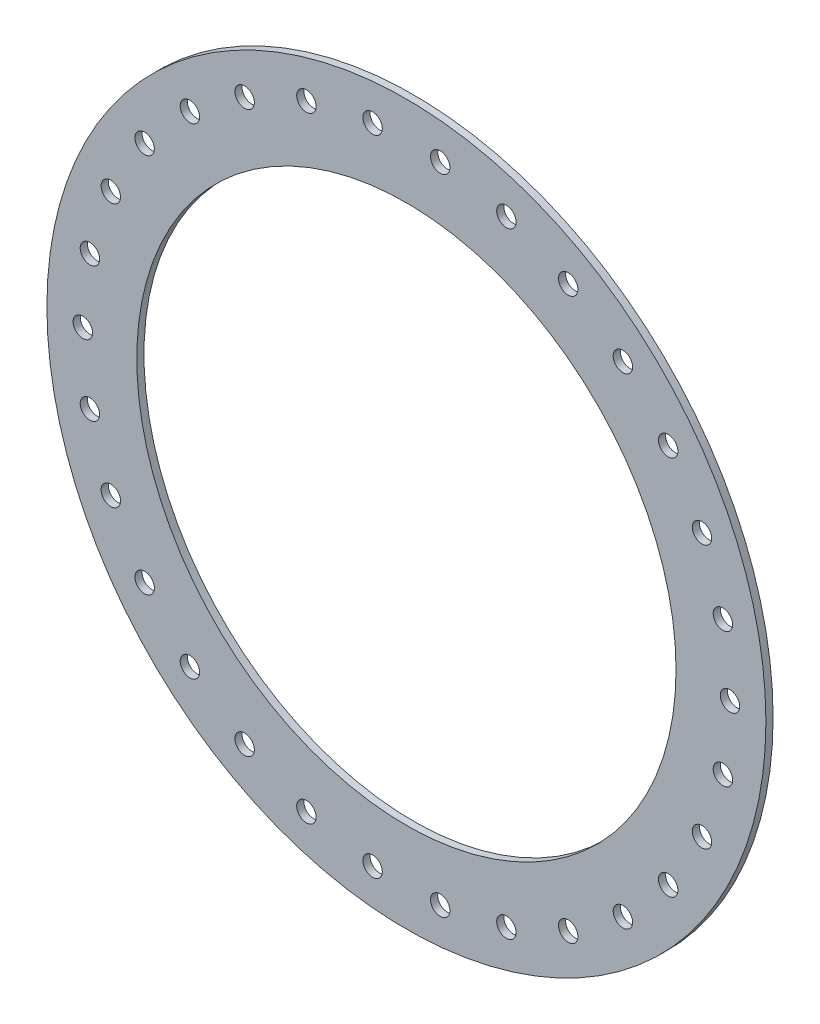
from build123d import *

# Parameters (mm, degrees)
CROQUIS1_R              = 200
CROQUIS1_R_2            = 150
CROQUIS1_R_3            = 5.4
SALIENTE_EXTRUIR1_DEPTH = 4


with BuildPart() as part:
    # Croquis1 → Saliente-Extruir1 (new body)
    with BuildSketch(Plane.XY):
        Circle(CROQUIS1_R)
        Circle(CROQUIS1_R_2, mode=Mode.SUBTRACT)
        with Locations((145.623058987, 105.801345413)):
            Circle(CROQUIS1_R_3, mode=Mode.SUBTRACT)
        with Locations((164.438182376, 73.212595754)):
            Circle(CROQUIS1_R_3, mode=Mode.SUBTRACT)
        with Locations((176.066568132, 37.424104347)):
            Circle(CROQUIS1_R_3, mode=Mode.SUBTRACT)
        with Locations((180, 0)):
            Circle(CROQUIS1_R_3, mode=Mode.SUBTRACT)
        with Locations((176.066568132, -37.424104347)):
            Circle(CROQUIS1_R_3, mode=Mode.SUBTRACT)
        with Locations((164.438182376, -73.212595754)):
            Circle(CROQUIS1_R_3, mode=Mode.SUBTRACT)
        with Locations((145.623058987, -105.801345413)):
            Circle(CROQUIS1_R_3, mode=Mode.SUBTRACT)
        with Locations((120.443509145, -133.766068586)):
            Circle(CROQUIS1_R_3, mode=Mode.SUBTRACT)
        with Locations((90, -155.884572681)):
            Circle(CROQUIS1_R_3, mode=Mode.SUBTRACT)
        with Locations((55.623058987, -171.190172933)):
            Circle(CROQUIS1_R_3, mode=Mode.SUBTRACT)
        with Locations((18.815123388, -179.013941166)):
            Circle(CROQUIS1_R_3, mode=Mode.SUBTRACT)
        with Locations((-18.815123388, -179.013941166)):
            Circle(CROQUIS1_R_3, mode=Mode.SUBTRACT)
        with Locations((-55.623058987, -171.190172933)):
            Circle(CROQUIS1_R_3, mode=Mode.SUBTRACT)
        with Locations((-90, -155.884572681)):
            Circle(CROQUIS1_R_3, mode=Mode.SUBTRACT)
        with Locations((-120.443509145, -133.766068586)):
            Circle(CROQUIS1_R_3, mode=Mode.SUBTRACT)
        with Locations((-145.623058987, -105.801345413)):
            Circle(CROQUIS1_R_3, mode=Mode.SUBTRACT)
        with Locations((-164.438182376, -73.212595754)):
            Circle(CROQUIS1_R_3, mode=Mode.SUBTRACT)
        with Locations((-176.066568132, -37.424104347)):
            Circle(CROQUIS1_R_3, mode=Mode.SUBTRACT)
        with Locations((-180, 0)):
            Circle(CROQUIS1_R_3, mode=Mode.SUBTRACT)
        with Locations((-176.066568132, 37.424104347)):
            Circle(CROQUIS1_R_3, mode=Mode.SUBTRACT)
        with Locations((-164.438182376, 73.212595754)):
            Circle(CROQUIS1_R_3, mode=Mode.SUBTRACT)
        with Locations((-145.623058987, 105.801345413)):
            Circle(CROQUIS1_R_3, mode=Mode.SUBTRACT)
        with Locations((-120.443509145, 133.766068586)):
            Circle(CROQUIS1_R_3, mode=Mode.SUBTRACT)
        with Locations((-90, 155.884572681)):
            Circle(CROQUIS1_R_3, mode=Mode.SUBTRACT)
        with Locations((-55.623058987, 171.190172933)):
            Circle(CROQUIS1_R_3, mode=Mode.SUBTRACT)
        with Locations((-18.815123388, 179.013941166)):
            Circle(CROQUIS1_R_3, mode=Mode.SUBTRACT)
        with Locations((18.815123388, 179.013941166)):
            Circle(CROQUIS1_R_3, mode=Mode.SUBTRACT)
        with Locations((55.623058987, 171.190172933)):
            Circle(CROQUIS1_R_3, mode=Mode.SUBTRACT)
        with Locations((90, 155.884572681)):
            Circle(CROQUIS1_R_3, mode=Mode.SUBTRACT)
        with Locations((120.443509145, 133.766068586)):
            Circle(CROQUIS1_R_3, mode=Mode.SUBTRACT)
    extrude(amount=SALIENTE_EXTRUIR1_DEPTH)


solid = part.part
